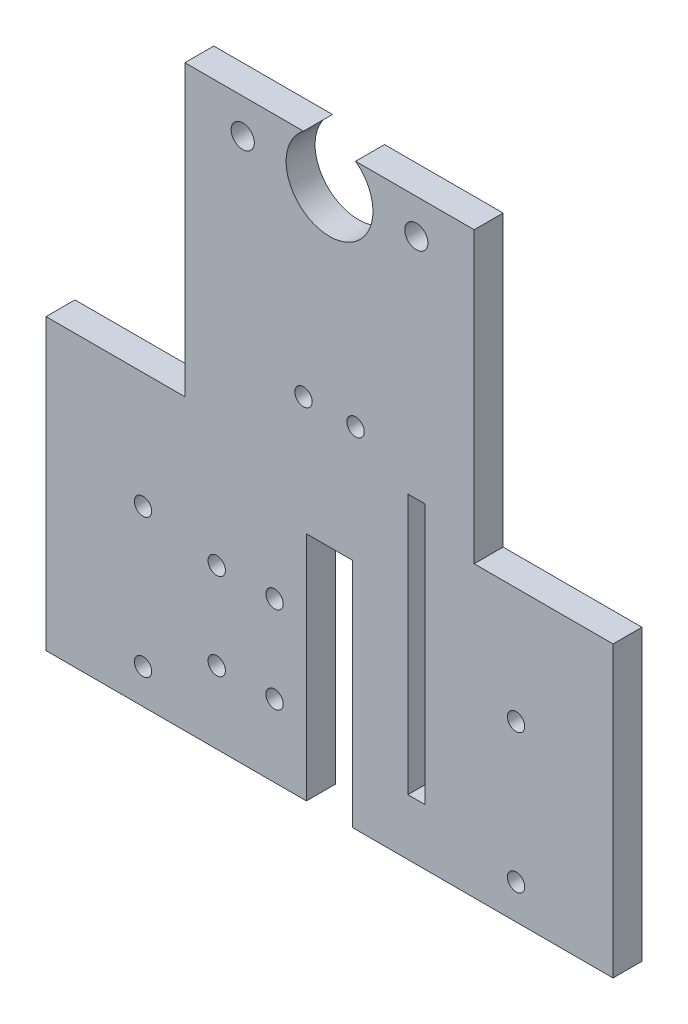
from build123d import *

# Parameters (mm, degrees)
SKETCH_1_R          = 2
EXTRUDE_1_DEPTH     = 5
SKETCH_2_R          = 7.5
CUT_EXTRUDE_1_DEPTH = 10
SKETCH_3_W          = 8
SKETCH_3_H          = 40
CUT_EXTRUDE_2_DEPTH = 71.185468581
SKETCH_6_R          = 1.5
CUT_EXTRUDE_3_DEPTH = 71.185468581
SKETCH_7_R          = 4.5
SKETCH_7_R_2        = 1.5
CUT_EXTRUDE_4_DEPTH = 2
SKETCH_8_W          = 3
SKETCH_8_H          = 45
CUT_EXTRUDE_5_DEPTH = 71.185468581
SKETCH_9_R          = 1.5
CUT_EXTRUDE_6_DEPTH = 10
SKETCH_10_R         = 1.5
CUT_EXTRUDE_7_DEPTH = 10


with BuildPart() as part:
    # 草图1 → 凸台-拉伸1 (new body)
    with BuildSketch(Plane.XY):
        Polygon((-25, 50), (25, 50), (25, 32.424322584), (25, 0), (49, 0), (49, -50), (25, -50), (-25, -50), (-49, -50), (-49, 0), (-25, 0), (-25, 32.424322584), align=None)
        with Locations((-15, 44)):
            Circle(SKETCH_1_R, mode=Mode.SUBTRACT)
        with Locations(Location((15, 44, 0), (0, 0, 180))):
            Circle(SKETCH_1_R, mode=Mode.SUBTRACT)
    extrude(amount=EXTRUDE_1_DEPTH)

    # 草图2 → 切除-拉伸1 (cut)
    with BuildSketch(Plane.XY.offset(5)):
        with Locations((0, 44)):
            Circle(SKETCH_2_R)
    extrude(amount=-CUT_EXTRUDE_1_DEPTH, mode=Mode.SUBTRACT)

    # 草图3 → 切除-拉伸2 (cut, through all)
    with BuildSketch(Plane(origin=(0, 0, 0), x_dir=(-1, 0, 0), z_dir=(0, 0, -1))):
        with Locations((0, -30)):
            Rectangle(SKETCH_3_W, SKETCH_3_H)
    extrude(amount=-CUT_EXTRUDE_2_DEPTH, mode=Mode.SUBTRACT)

    # 草图6 → 切除-拉伸3 (cut, through all)
    with BuildSketch(Plane(origin=(0, 0, 0), x_dir=(-1, 0, 0), z_dir=(0, 0, -1))):
        with Locations(Location((-32.235018023, -44, 0), (0, 0, 180))):
            Circle(SKETCH_6_R)
        with Locations(Location((-32.235018023, -20, 0), (0, 0, 180))):
            Circle(SKETCH_6_R)
        with Locations((32.235018023, -44)):
            Circle(SKETCH_6_R)
        with Locations((32.235018023, -20)):
            Circle(SKETCH_6_R)
    extrude(amount=-CUT_EXTRUDE_3_DEPTH, mode=Mode.SUBTRACT)

    # 草图7 → 切除-拉伸4 (cut)
    # profile 1 of 4: a face of its own
    with BuildSketch(Plane(origin=(0, 0, 0), x_dir=(-1, 0, 0), z_dir=(0, 0, -1))):
        with Locations((-32.235018023, -44)):
            Circle(SKETCH_7_R)
        with Locations((-32.235018023, -44)):
            Circle(SKETCH_7_R_2, mode=Mode.SUBTRACT)
    # profile 2 of 4: a face of its own
    with BuildSketch(Plane(origin=(0, 0, 0), x_dir=(-1, 0, 0), z_dir=(0, 0, -1))):
        with Locations((-32.235018023, -20)):
            Circle(SKETCH_7_R)
        with Locations((-32.235018023, -20)):
            Circle(SKETCH_7_R_2, mode=Mode.SUBTRACT)
    # profile 3 of 4: a face of its own
    with BuildSketch(Plane(origin=(0, 0, 0), x_dir=(-1, 0, 0), z_dir=(0, 0, -1))):
        with Locations((32.235018023, -20)):
            Circle(SKETCH_7_R)
        with Locations((32.235018023, -20)):
            Circle(SKETCH_7_R_2, mode=Mode.SUBTRACT)
    # profile 4 of 4: a face of its own
    with BuildSketch(Plane(origin=(0, 0, 0), x_dir=(-1, 0, 0), z_dir=(0, 0, -1))):
        with Locations((32.235018023, -44)):
            Circle(SKETCH_7_R)
        with Locations((32.235018023, -44)):
            Circle(SKETCH_7_R_2, mode=Mode.SUBTRACT)
    extrude(amount=-CUT_EXTRUDE_4_DEPTH, mode=Mode.SUBTRACT)

    # 草图8 → 切除-拉伸5 (cut, through all)
    with BuildSketch(Plane(origin=(0, 0, 0), x_dir=(-1, 0, 0), z_dir=(0, 0, -1))):
        with Locations((-15.035926406, -17.789740129)):
            Rectangle(SKETCH_8_W, SKETCH_8_H)
    extrude(amount=-CUT_EXTRUDE_5_DEPTH, mode=Mode.SUBTRACT)

    # 草图9 → 切除-拉伸6 (cut)
    with BuildSketch(Plane(origin=(0, 0, 0), x_dir=(-1, 0, 0), z_dir=(0, 0, -1))):
        with Locations((-4.5, 10.25)):
            Circle(SKETCH_9_R)
        with Locations(Location((4.5, 10.25, 0), (0, 0, 180))):
            Circle(SKETCH_9_R)
    extrude(amount=-CUT_EXTRUDE_6_DEPTH, mode=Mode.SUBTRACT)

    # 草图10 → 切除-拉伸7 (cut)
    with BuildSketch(Plane(origin=(0, 0, 0), x_dir=(-1, 0, 0), z_dir=(0, 0, -1))):
        with Locations((9.5, -22.5)):
            Circle(SKETCH_10_R)
        with Locations((19.5, -22.5)):
            Circle(SKETCH_10_R)
        with Locations((19.5, -37.5)):
            Circle(SKETCH_10_R)
        with Locations((9.5, -37.5)):
            Circle(SKETCH_10_R)
    extrude(amount=-CUT_EXTRUDE_7_DEPTH, mode=Mode.SUBTRACT)


solid = part.part
